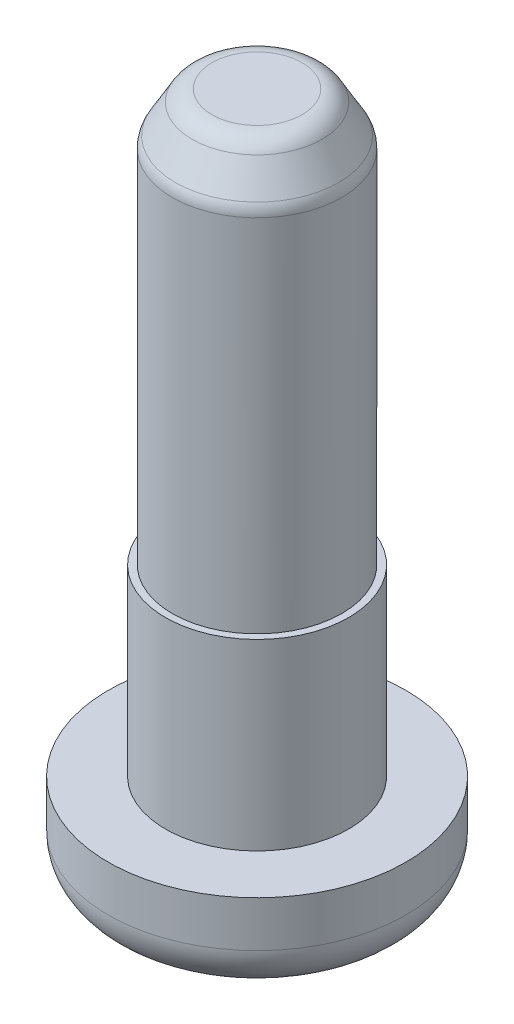
from build123d import *

# Parameters (mm, degrees)
SKETCH1_R           = 4
BOSS_EXTRUDE1_DEPTH = 26
SKETCH2_R           = 6.5
BOSS_EXTRUDE2_DEPTH = 4
CUT_EXTRUDE1_START  = -18
SKETCH3_R           = 4
SKETCH3_R_2         = 3.7
CUT_EXTRUDE1_DEPTH  = 18
FILLET2_R           = 2
CHAMFER1_SIZE       = 2
CHAMFER1_SIZE2      = 1.154700538
FILLET3_R           = 1


with BuildPart() as part:
    # Sketch1 → Boss-Extrude1 (new body)
    with BuildSketch(Plane(origin=(0, 0, 0), x_dir=(1, 0, 0), z_dir=(0, 1, 0))):
        with Locations(Location((0, 0, 0), (0, 0, 90))):
            Circle(SKETCH1_R)
    extrude(amount=BOSS_EXTRUDE1_DEPTH)

    # Sketch2 → Boss-Extrude2 (add)
    with BuildSketch(Plane.XZ):
        with Locations(Location((0, 0, 0), (0, 0, 270))):
            Circle(SKETCH2_R)
    extrude(amount=BOSS_EXTRUDE2_DEPTH)

    # Sketch3 → Cut-Extrude1 (cut)
    with BuildSketch(Plane(origin=(0, 26, 0), x_dir=(1, 0, 0), z_dir=(0, 1, 0)).offset(CUT_EXTRUDE1_START)):
        with Locations(Location((0, 0, 0), (0, 0, 90))):
            Circle(SKETCH3_R)
        with Locations(Location((0, 0, 0), (0, 0, 270))):
            Circle(SKETCH3_R_2, mode=Mode.SUBTRACT)
    extrude(amount=CUT_EXTRUDE1_DEPTH, mode=Mode.SUBTRACT)

    # Fillet2
    fillet2_edges = [part.edges().sort_by_distance(p)[0] for p in [
        (0, -4, 6.5),
    ]]
    fillet(fillet2_edges, radius=FILLET2_R)

    # Chamfer1
    chamfer1_edges = [part.edges().sort_by_distance(p)[0] for p in [
        (0, 26, -3.7),
    ]]
    chamfer1_side = [part.faces().sort_by_distance(p)[0] for p in [
        (0, 17, -3.7),
    ]]
    chamfer(chamfer1_edges, length=CHAMFER1_SIZE, length2=CHAMFER1_SIZE2, reference=chamfer1_side[0])

    # Fillet3
    fillet3_edges = [part.edges().sort_by_distance(p)[0] for p in [
        (0, 26, -2.545299462),
        (0, 24, -3.7),
    ]]
    fillet(fillet3_edges, radius=FILLET3_R)


solid = part.part
